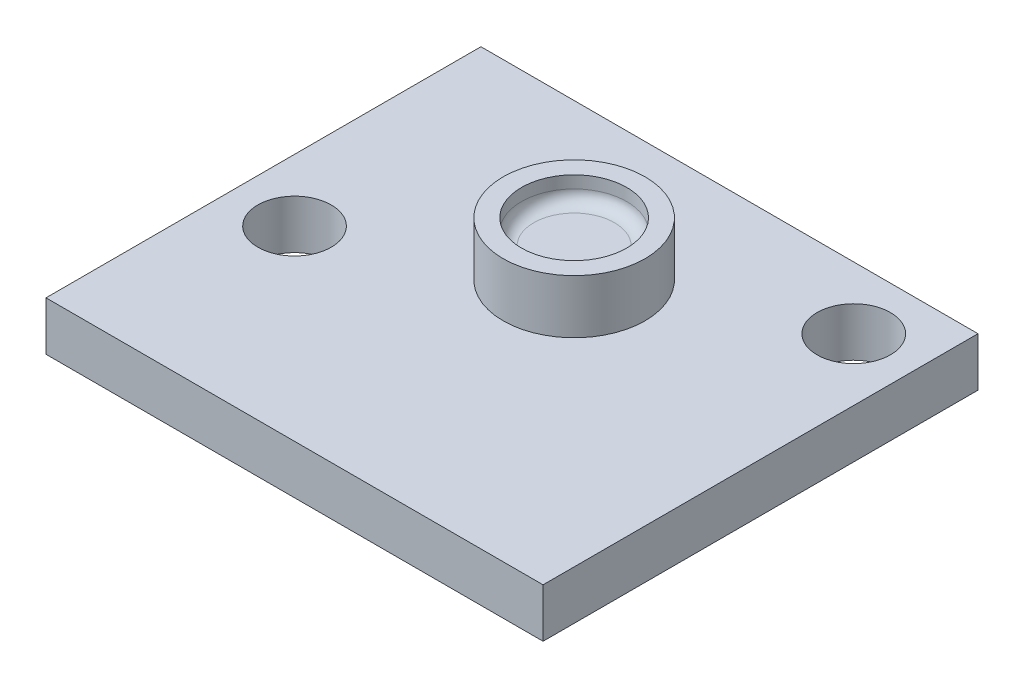
from build123d import *

# Parameters (mm, degrees)
SKETCH2_W           = 20.32
SKETCH2_H           = 17.78
SKETCH2_R           = 1.5
BOSS_EXTRUDE1_DEPTH = 2
SKETCH3_R           = 2.9
BOSS_EXTRUDE2_DEPTH = 2.2
SKETCH4_R           = 2.15
CUT_EXTRUDE1_DEPTH  = 1
FILLET2_R           = 0.5


with BuildPart() as part:
    # Sketch2 → Boss-Extrude1 (new body)
    with BuildSketch(Plane(origin=(0, 0, 0), x_dir=(1, 0, 0), z_dir=(0, 1, 0))):
        Rectangle(SKETCH2_W, SKETCH2_H)
        with Locations(Location((7.62, 6.35, 0), (0, 0, 270))):
            Circle(SKETCH2_R, mode=Mode.SUBTRACT)
        with Locations(Location((-7.62, -1.27, 0), (0, 0, 270))):
            Circle(SKETCH2_R, mode=Mode.SUBTRACT)
    extrude(amount=BOSS_EXTRUDE1_DEPTH)

    # Sketch3 → Boss-Extrude2 (add)
    with BuildSketch(Plane(origin=(0, 2, 0), x_dir=(1, 0, 0), z_dir=(0, 1, 0))):
        with Locations(Location((0, 2.54, 0), (0, 0, 270))):
            Circle(SKETCH3_R)
    extrude(amount=BOSS_EXTRUDE2_DEPTH)

    # Sketch4 → Cut-Extrude1 (cut)
    with BuildSketch(Plane(origin=(0, 4.2, 0), x_dir=(1, 0, 0), z_dir=(0, 1, 0))):
        with Locations(Location((0, 2.54, 0), (0, 0, 270))):
            Circle(SKETCH4_R)
    extrude(amount=-CUT_EXTRUDE1_DEPTH, mode=Mode.SUBTRACT)

    # Fillet2
    fillet2_edges = [part.edges().sort_by_distance(p)[0] for p in [
        (0, 3.2, -4.69),
    ]]
    fillet(fillet2_edges, radius=FILLET2_R)


solid = part.part
